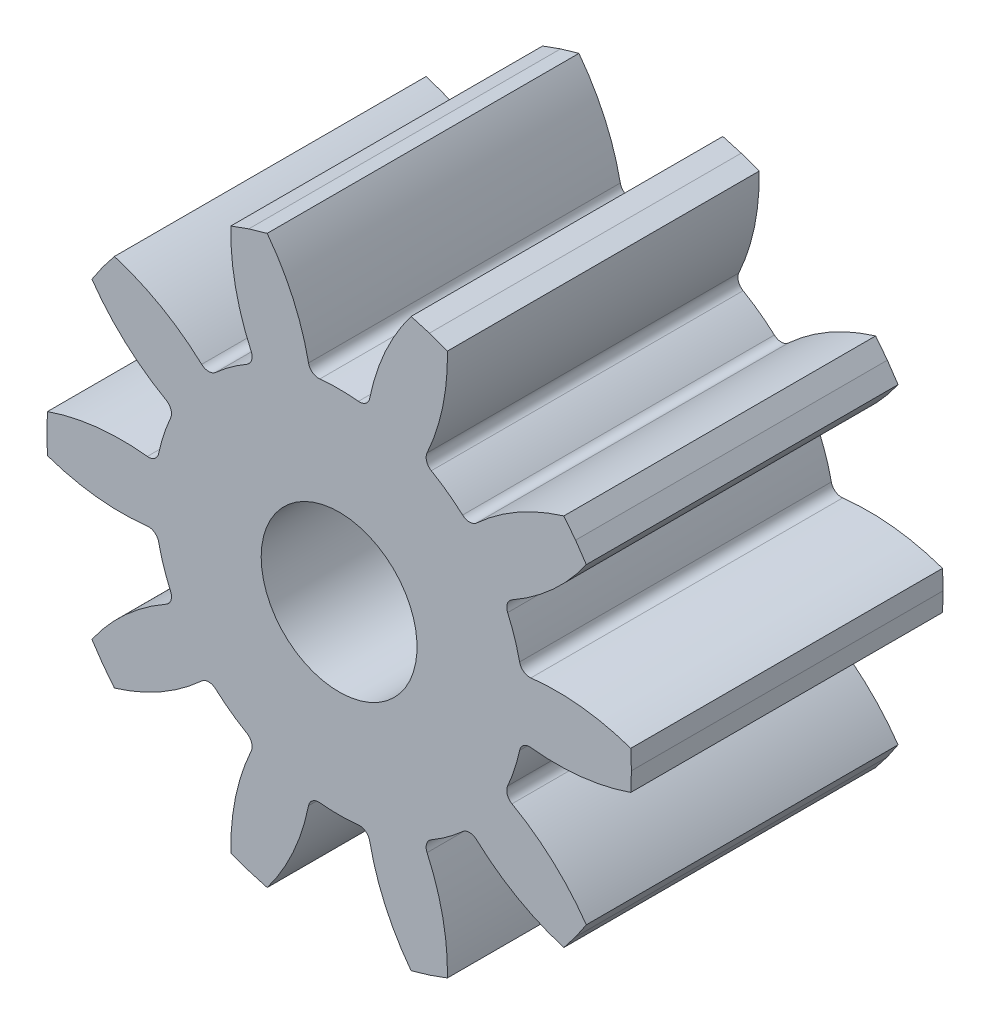
from build123d import *

# Parameters (mm, degrees)
BOSS_EXTRUDE1_DEPTH      = 10
FILLET1_R                = 0.3325
CIRPATTERN1_COUNT        = 10
FILLET1_OF_CIRPATTERN1_R = 0.3325
CUT_EXTRUDE1_REACH       = 18.446
SKETCH2_R                = 2.5


with BuildPart() as part:
    # Sketch1 → Boss-Extrude1 (new body)
    with BuildSketch(Plane.XY):
        with BuildLine():
            Line((9.354927405, 0.613154337), (9.375, 0))
            Line((9.375, 0), (9.354927405, -0.613154337))
            ThreePointArc((9.354927405, -0.613154337), (7.619096435, -0.986300983), (5.844645755, -0.925700947))
            ThreePointArc((5.844645755, -0.925700947), (5.753999004, -1.381412941), (5.627876935, -1.828608064))
            Line((5.627876935, -1.828608064), (0, 0))
            Line((0, 0), (5.627876935, 1.828608064))
            ThreePointArc((5.627876935, 1.828608064), (5.753999004, 1.381412941), (5.844645755, 0.925700947))
            ThreePointArc((5.844645755, 0.925700947), (7.619096435, 0.986300983), (9.354927405, 0.613154337))
        make_face()
    boss_extrude1 = extrude(amount=BOSS_EXTRUDE1_DEPTH)

    # Fillet1
    fillet1_edges = [part.edges().sort_by_distance(p)[0] for p in [
        (5.844645755, 0.925700947, 5),
        (5.844645755, -0.925700947, 5),
    ]]
    fillet(fillet1_edges, radius=FILLET1_R)

    # CirPattern1: Boss-Extrude1 ×10 about axis
    cirpattern1_axis = Axis((0, 0, 0), (0, 0, 1))
    for i in range(1, CIRPATTERN1_COUNT):
        add(boss_extrude1.rotate(cirpattern1_axis, i * 360 / CIRPATTERN1_COUNT))

    # Fillet1 of CirPattern1
    fillet1_of_cirpattern1_edges = [part.edges().sort_by_distance(p)[0] for p in [
        (4.184304378, 4.184304378, 5),
        (5.272531107, 2.686488782, 5),
        (0.925700947, 5.844645755, 5),
        (2.686488782, 5.272531107, 5),
        (-2.686488782, 5.272531107, 5),
        (-0.925700947, 5.844645755, 5),
        (-5.272531107, 2.686488782, 5),
        (-4.184304378, 4.184304378, 5),
        (-5.844645755, -0.925700947, 5),
        (-5.844645755, 0.925700947, 5),
        (-4.184304378, -4.184304378, 5),
        (-5.272531107, -2.686488782, 5),
        (-0.925700947, -5.844645755, 5),
        (-2.686488782, -5.272531107, 5),
        (2.686488782, -5.272531107, 5),
        (0.925700947, -5.844645755, 5),
        (5.272531107, -2.686488782, 5),
        (4.184304378, -4.184304378, 5),
    ]]
    fillet(fillet1_of_cirpattern1_edges, radius=FILLET1_OF_CIRPATTERN1_R)

    # Sketch2 → Cut-Extrude1 (cut, up to next)
    with BuildSketch(Plane(origin=(0, 0, 0), x_dir=(-1, 0, 0), z_dir=(0, 0, -1)), mode=Mode.PRIVATE) as cut_extrude1_sk1:
        Circle(SKETCH2_R)
    cut_extrude1_tool1 = extrude(cut_extrude1_sk1.sketch, amount=-CUT_EXTRUDE1_REACH, mode=Mode.PRIVATE) & part.part
    add(cut_extrude1_tool1.solids().sort_by_distance((0, 0, 0))[0], mode=Mode.SUBTRACT)


solid = part.part
